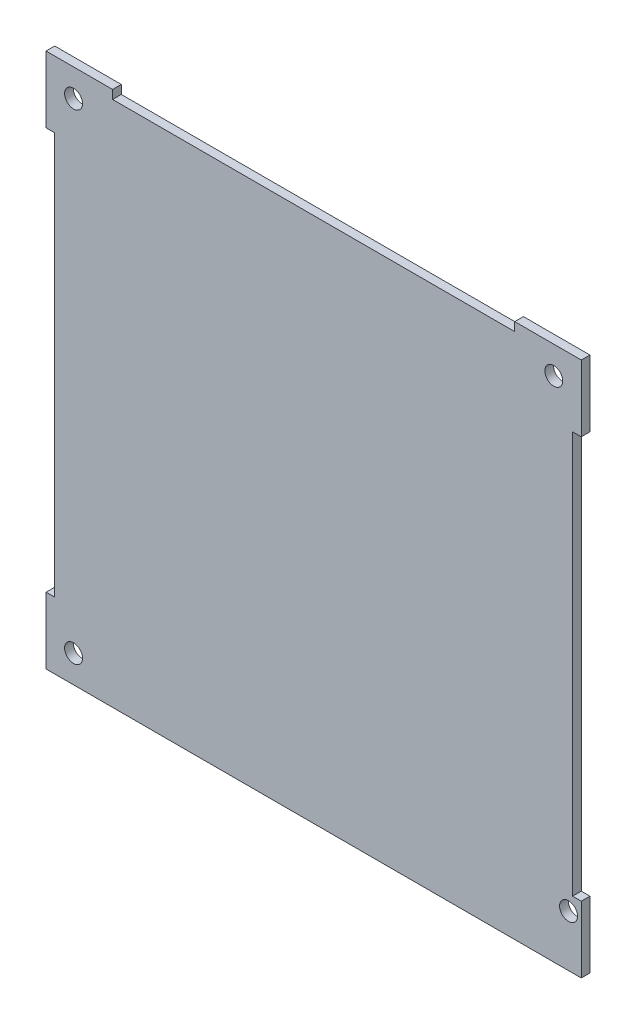
from build123d import *

# Parameters (mm, degrees)
SKETCH1_W                  = 92.5
SKETCH1_H                  = 92.5
BOSS_EXTRUDE1_DEPTH        = 1.5
F_3_1_3_1_DIAMETER_HOLE1_D = 3.1
SKETCH4_W                  = 1.5
SKETCH4_H                  = 69.5
SKETCH4_W_2                = 69.5
SKETCH4_H_2                = 1.5
CUT_EXTRUDE1_DEPTH         = 10


with BuildPart() as part:
    # Sketch1 → Boss-Extrude1 (new body)
    with BuildSketch(Plane.XY):
        Rectangle(SKETCH1_W, SKETCH1_H)
    extrude(amount=BOSS_EXTRUDE1_DEPTH)

    # Ø3.1 (3.1) Diameter Hole1 (through all)
    with Locations(Plane.XY.offset(1.5)):
        with Locations((-41.5, 41.5), (41.5, 41.5), (44.05, -37.33), (-41.5, -41.5)):
            Hole(F_3_1_3_1_DIAMETER_HOLE1_D / 2)

    # Sketch4 → Cut-Extrude1 (cut)
    with BuildSketch(Plane(origin=(0, 0, 0), x_dir=(-1, 0, 0), z_dir=(0, 0, -1))):
        with Locations((-45.5, 0)):
            Rectangle(SKETCH4_W, SKETCH4_H)
        with Locations((45.5, 0)):
            Rectangle(SKETCH4_W, SKETCH4_H)
        with Locations((0, 45.5)):
            Rectangle(SKETCH4_W_2, SKETCH4_H_2)
    extrude(amount=-CUT_EXTRUDE1_DEPTH, mode=Mode.SUBTRACT)


solid = part.part
